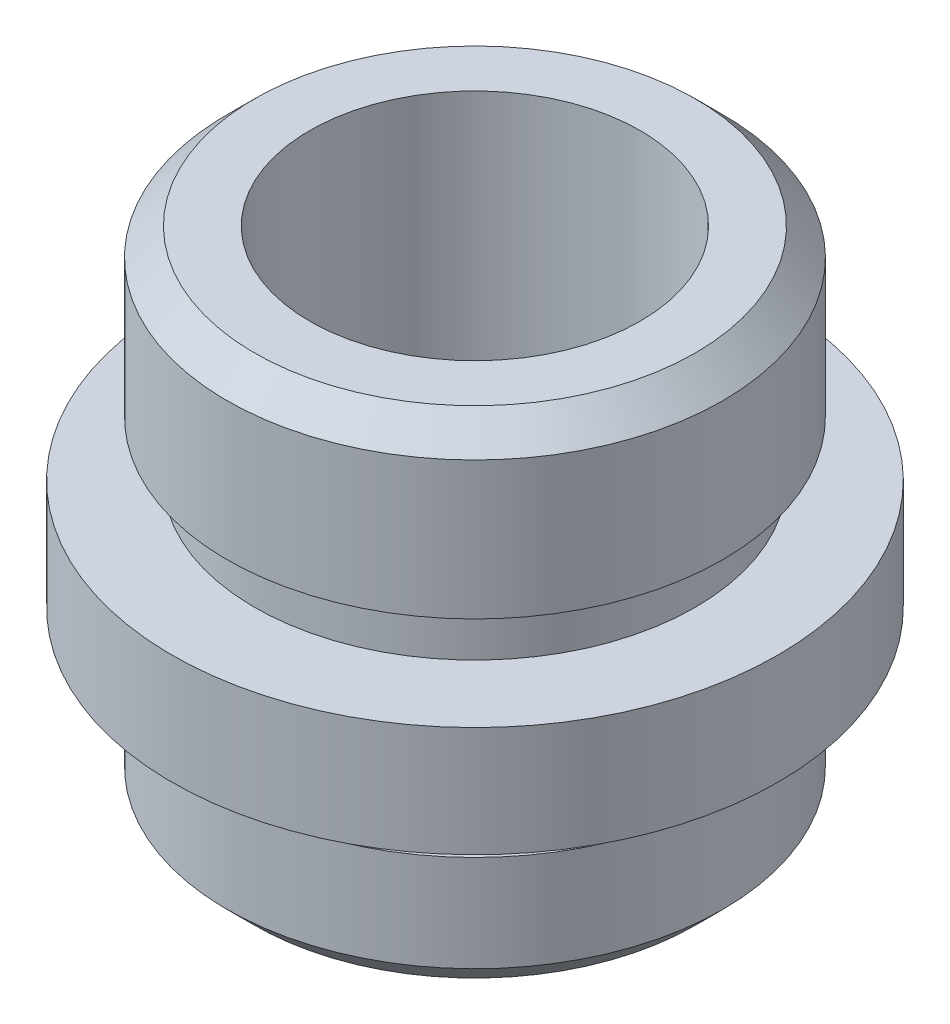
from build123d import *


with BuildPart() as part:
    # Sketch1 → Revolve2 (revolve)
    with BuildSketch(Plane.XY, mode=Mode.PRIVATE) as revolve2_sk:
        Polygon((-12, 0), (-12, -36), (-16, -36), (-18, -34), (-18, -27), (-16, -27), (-16, -24), (-22, -24), (-22, -16), (-16, -16), (-16, -12), (-18, -12), (-18, -2), (-16, 0), align=None)
    revolve(revolve2_sk.sketch.rotate(Axis((0, -1000, 0), (0, 1, 0)), 180), axis=Axis((0, -1000, 0), (0, 1, 0)))


solid = part.part
